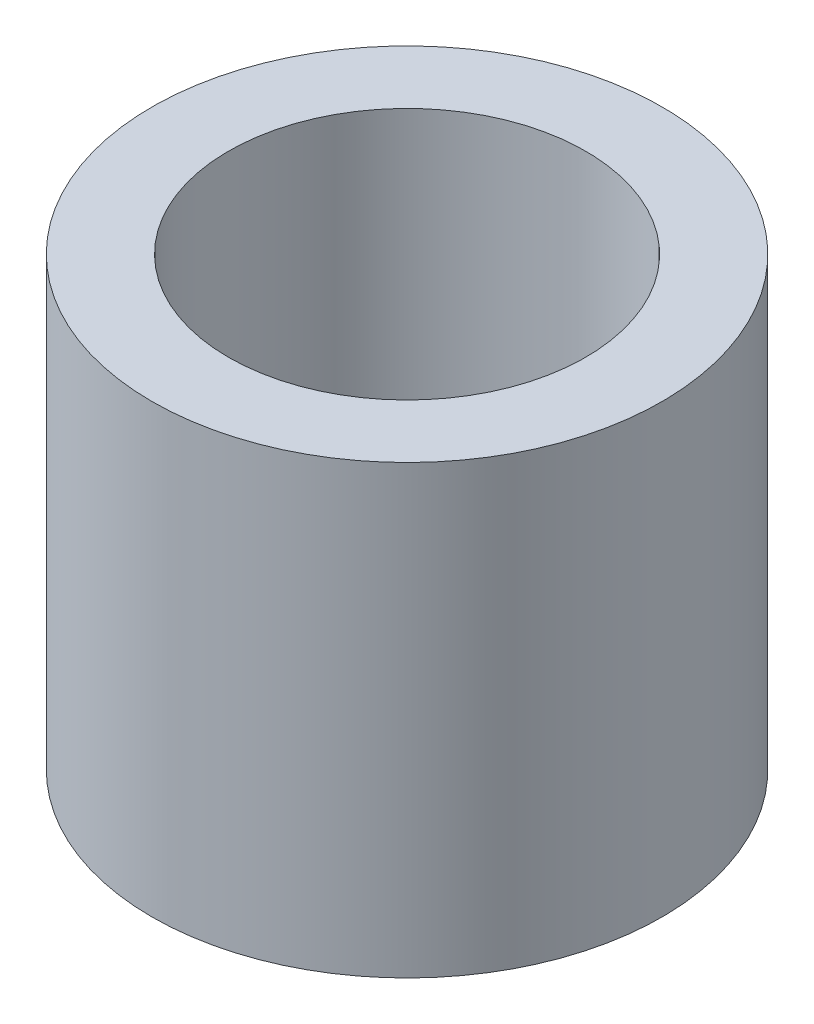
from build123d import *

# Parameters (mm, degrees)
SKETCH1_R           = 6.35
SKETCH1_R_2         = 4.445
BOSS_EXTRUDE1_DEPTH = 5.55625


with BuildPart() as part:
    # Sketch1 → Boss-Extrude1 (new, symmetric)
    with BuildSketch(Plane(origin=(0, 0, 0), x_dir=(1, 0, 0), z_dir=(0, 1, 0))):
        with Locations(Location((0, 0, 0), (0, 0, 270))):
            Circle(SKETCH1_R)
        with Locations(Location((0, 0, 0), (0, 0, 270))):
            Circle(SKETCH1_R_2, mode=Mode.SUBTRACT)
    extrude(amount=BOSS_EXTRUDE1_DEPTH, both=True)


solid = part.part
